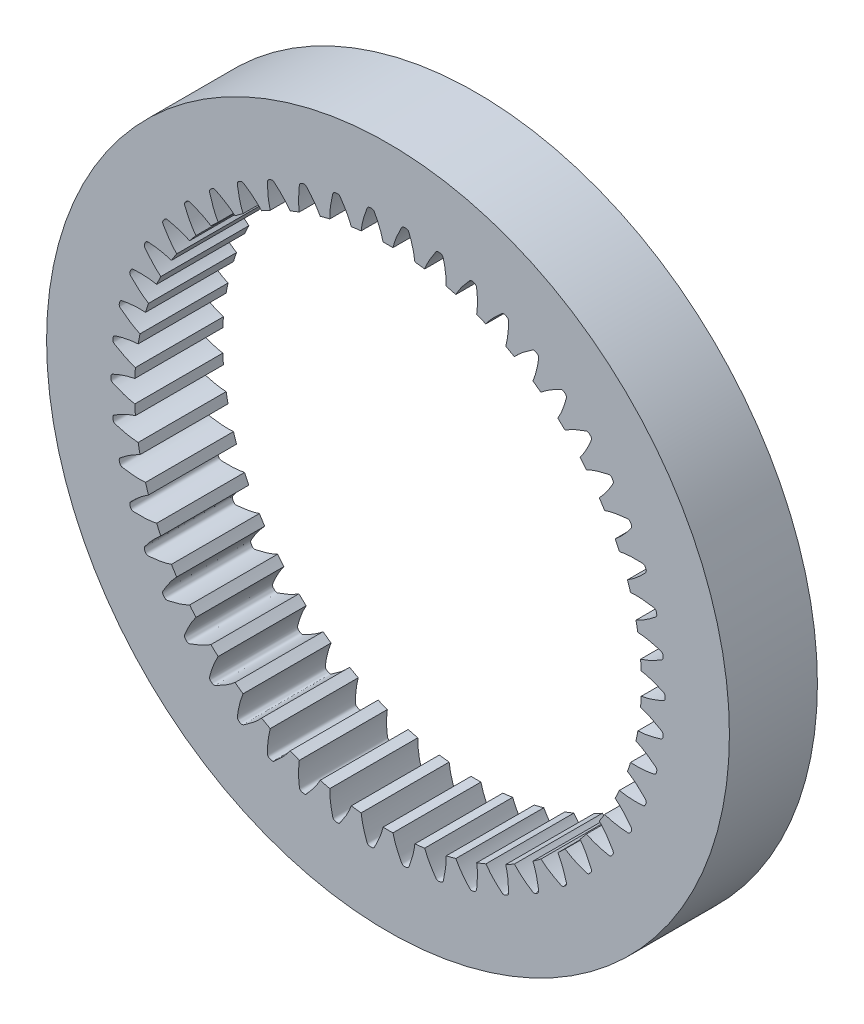
from build123d import *

# Parameters (mm, degrees)
SKETCHREVOLVESPURGEAR_W       = 10
SKETCHREVOLVESPURGEAR_H       = 10
TOOTHEXTRUDECUTSPURGEAR_DEPTH = 5
PATTERNSPURGEAR_COUNT         = 50


with BuildPart() as part:
    # SketchRevolveSpurGear → SpurGear (revolve)
    with BuildSketch(Plane(origin=(0, 0, 0), x_dir=(0, 0, -1), z_dir=(1, 0, 0))):
        with Locations((0, 33.8)):
            Rectangle(SKETCHREVOLVESPURGEAR_W, SKETCHREVOLVESPURGEAR_H)
    revolve(axis=Axis((0, 0, 0), (0, 0, -1)))

    # SketchToothSpurGear → ToothExtrudeCutSpurGear (cut, symmetric)
    with BuildSketch(Plane.XY):
        with BuildLine():
            ThreePointArc((28.737363036, -1.253925664), (28.764706914, 0), (28.737363036, 1.253925664))
            add(Edge.make_bspline(
                [(28.737363036, 1.253925664), (28.864045938, 1.233906584), (29.06501388, 1.195394912), (29.346346096, 1.129305162), (29.591104456, 1.064186459), (29.85716522, 0.984938024), (30.144000204, 0.890430239), (30.450455339, 0.778647803), (30.777691874, 0.651420618), (31.071816554, 0.515634579), (31.285420369, 0.436127308), (31.379392679, 0.365463477), (31.415050979, 0.328888464), (31.445327654, 0.28776406), (31.469409967, 0.242736958), (31.49276092, 0.1796151), (31.500870503, 0.113137401), (31.499771001, 0.048046451), (31.500114499, 0), (31.499771001, -0.048046451), (31.500870503, -0.113137401), (31.49276092, -0.1796151), (31.469409967, -0.242736958), (31.445327654, -0.28776406), (31.415050979, -0.328888464), (31.379392679, -0.365463477), (31.285420369, -0.436127308), (31.071816554, -0.515634579), (30.777691874, -0.651420618), (30.450455339, -0.778647803), (30.144000204, -0.890430239), (29.85716522, -0.984938024), (29.591104456, -1.064186459), (29.346346096, -1.129305162), (29.06501388, -1.195394912), (28.864045938, -1.233906584), (28.737363036, -1.253925664)],
                knots=[0, 0, 0, 0, 0.060156699, 0.095945407, 0.135541022, 0.178943543, 0.22615297, 0.277169304, 0.331992543, 0.390622689, 0.429645943, 0.437604728, 0.445563514, 0.453522299, 0.461481085, 0.469439871, 0.484977605, 0.492488811, 0.5, 0.507511189, 0.515022395, 0.530560129, 0.538518915, 0.546477701, 0.554436486, 0.562395272, 0.570354057, 0.609377311, 0.668007457, 0.722830696, 0.77384703, 0.821056457, 0.864458978, 0.904054593, 0.939843301, 1, 1, 1, 1], degree=3))
        make_face()
    toothextrudecutspurgear = extrude(amount=TOOTHEXTRUDECUTSPURGEAR_DEPTH, both=True, mode=Mode.SUBTRACT)

    # PatternSpurGear: ToothExtrudeCutSpurGear ×50 about axis
    patternspurgear_axis = Axis((0, 0, 50), (0, 0, -1))
    for i in range(1, PATTERNSPURGEAR_COUNT):
        add(toothextrudecutspurgear.rotate(patternspurgear_axis, i * 360 / PATTERNSPURGEAR_COUNT), mode=Mode.SUBTRACT)


solid = part.part
